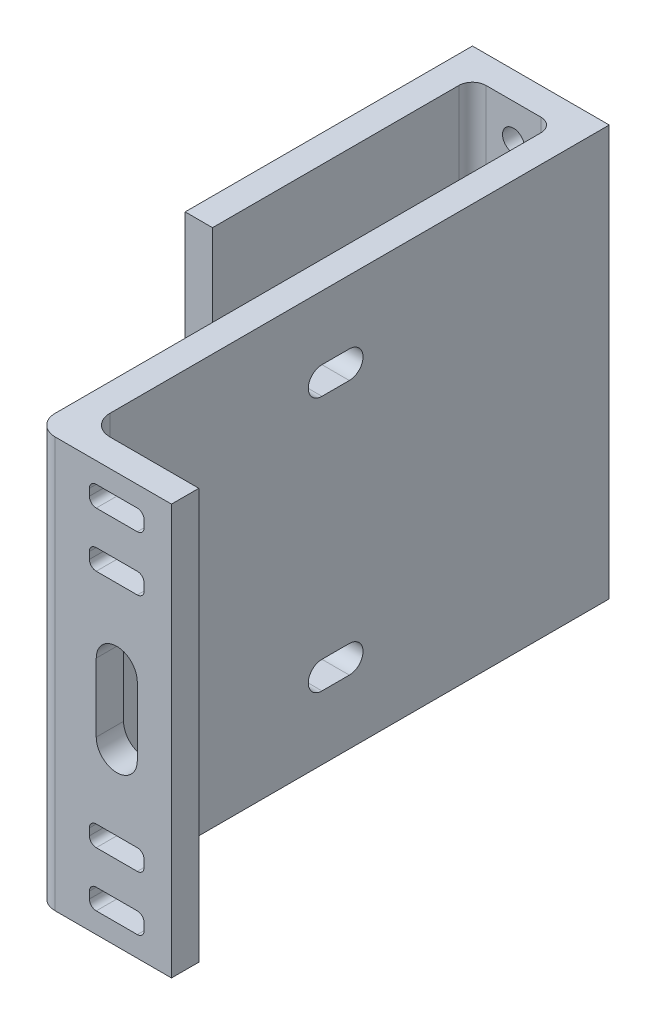
from build123d import *

# Parameters (mm, degrees)
BOSS_EXTRUDE1_DEPTH = 30
SKETCH2_W           = 8
SKETCH2_H           = 3
CUT_EXTRUDE1_DEPTH  = 86.743804441
FILLET1_R           = 1
CUT_EXTRUDE2_REACH  = 89.75
CUT_EXTRUDE3_REACH  = 86.119
SKETCH5_R           = 1.6
CUT_EXTRUDE4_DEPTH  = 86.743804441
FILLET2_R           = 2
FILLET3_R           = 3


with BuildPart() as part:
    # Sketch1 → Boss-Extrude1 (new, symmetric)
    with BuildSketch(Plane(origin=(0, 0, 0), x_dir=(1, 0, 0), z_dir=(0, 1, 0))):
        Polygon((-6, 0), (6, 0), (6, -76), (10, -76), (26, -76), (26, -72), (10, -72), (10, 4), (-10, 4), (-10, -38), (-6, -38), align=None)
    extrude(amount=BOSS_EXTRUDE1_DEPTH, both=True)

    # Sketch2 → Cut-Extrude1 (cut, through all)
    with BuildSketch(Plane(origin=(0, 0, 72), x_dir=(-1, 0, 0), z_dir=(0, 0, -1))):
        with BuildLine():
            Line((-21, -5), (-21, 5))
            ThreePointArc((-21, 5), (-18, 8), (-15, 5))
            Line((-15, 5), (-15, -5))
            ThreePointArc((-15, -5), (-18, -8), (-21, -5))
        make_face()
        with Locations((-18, 25.5)):
            Rectangle(SKETCH2_W, SKETCH2_H)
        with Locations((-18, 17.5)):
            Rectangle(SKETCH2_W, SKETCH2_H)
        with Locations((-18, -17.5)):
            Rectangle(SKETCH2_W, SKETCH2_H)
        with Locations((-18, -25.5)):
            Rectangle(SKETCH2_W, SKETCH2_H)
    extrude(amount=-CUT_EXTRUDE1_DEPTH, mode=Mode.SUBTRACT)

    # Fillet1
    fillet1_edges = [part.edges().sort_by_distance(p)[0] for p in [
        (22, 24, 74),
        (22, 27, 74),
        (14, 27, 74),
        (14, 24, 74),
        (22, 16, 74),
        (22, 19, 74),
        (14, 19, 74),
        (14, 16, 74),
        (14, -19, 74),
        (22, -19, 74),
        (22, -16, 74),
        (14, -16, 74),
        (14, -27, 74),
        (22, -27, 74),
        (22, -24, 74),
        (14, -24, 74),
    ]]
    fillet(fillet1_edges, radius=FILLET1_R)

    # Sketch3 → Cut-Extrude2 (cut, up to next)
    with BuildSketch(Plane(origin=(-6, 0, 0), x_dir=(0, 0, -1), z_dir=(1, 0, 0)), mode=Mode.PRIVATE) as cut_extrude2_sk1:
        with BuildLine():
            Line((-35.6, -2), (-35.6, 2))
            ThreePointArc((-35.6, 2), (-33.6, 4), (-31.6, 2))
            Line((-31.6, 2), (-31.6, -2))
            ThreePointArc((-31.6, -2), (-33.6, -4), (-35.6, -2))
        make_face()
    cut_extrude2_tool1 = extrude(cut_extrude2_sk1.sketch, amount=-CUT_EXTRUDE2_REACH, mode=Mode.PRIVATE) & part.part
    # Sketch3 → Cut-Extrude2 (cut, up to next)
    with BuildSketch(Plane(origin=(-6, 0, 0), x_dir=(0, 0, -1), z_dir=(1, 0, 0)), mode=Mode.PRIVATE) as cut_extrude2_sk2:
        with BuildLine():
            Line((-2.4, -2), (-2.4, 2))
            ThreePointArc((-2.4, 2), (-4.4, 4), (-6.4, 2))
            Line((-6.4, 2), (-6.4, -2))
            ThreePointArc((-6.4, -2), (-4.4, -4), (-2.4, -2))
        make_face()
    cut_extrude2_tool2 = extrude(cut_extrude2_sk2.sketch, amount=-CUT_EXTRUDE2_REACH, mode=Mode.PRIVATE) & part.part
    add(cut_extrude2_tool1.solids().sort_by_distance((-6, 0, 33.6))[0], mode=Mode.SUBTRACT)
    add(cut_extrude2_tool2.solids().sort_by_distance((-6, 0, 4.4))[0], mode=Mode.SUBTRACT)

    # Sketch4 → Cut-Extrude3 (cut, up to next)
    with BuildSketch(Plane(origin=(10, 0, 0), x_dir=(0, 0, -1), z_dir=(1, 0, 0)), mode=Mode.PRIVATE) as cut_extrude3_sk1:
        with BuildLine():
            Line((-38, 20.65), (-34, 20.65))
            ThreePointArc((-34, 20.65), (-32, 18.65), (-34, 16.65))
            Line((-34, 16.65), (-38, 16.65))
            ThreePointArc((-38, 16.65), (-40, 18.65), (-38, 20.65))
        make_face()
    cut_extrude3_tool1 = extrude(cut_extrude3_sk1.sketch, amount=-CUT_EXTRUDE3_REACH, mode=Mode.PRIVATE) & part.part
    # Sketch4 → Cut-Extrude3 (cut, up to next)
    with BuildSketch(Plane(origin=(10, 0, 0), x_dir=(0, 0, -1), z_dir=(1, 0, 0)), mode=Mode.PRIVATE) as cut_extrude3_sk2:
        with BuildLine():
            Line((-38, -20.65), (-34, -20.65))
            ThreePointArc((-34, -20.65), (-32, -18.65), (-34, -16.65))
            Line((-34, -16.65), (-38, -16.65))
            ThreePointArc((-38, -16.65), (-40, -18.65), (-38, -20.65))
        make_face()
    cut_extrude3_tool2 = extrude(cut_extrude3_sk2.sketch, amount=-CUT_EXTRUDE3_REACH, mode=Mode.PRIVATE) & part.part
    add(cut_extrude3_tool1.solids().sort_by_distance((10, 18.65, 36))[0], mode=Mode.SUBTRACT)
    add(cut_extrude3_tool2.solids().sort_by_distance((10, -18.65, 36))[0], mode=Mode.SUBTRACT)

    # Sketch5 → Cut-Extrude4 (cut, through all)
    with BuildSketch(Plane.XY):
        with Locations((0, 25)):
            Circle(SKETCH5_R)
        with Locations(Location((0, -25, 0), (0, 0, 180))):
            Circle(SKETCH5_R)
    extrude(amount=-CUT_EXTRUDE4_DEPTH, mode=Mode.SUBTRACT)

    # Fillet2
    fillet2_edges = [part.edges().sort_by_distance(p)[0] for p in [
        (6, 0, 0),
        (-6, 0, 0),
    ]]
    fillet(fillet2_edges, radius=FILLET2_R)

    # Fillet3
    fillet3_edges = [part.edges().sort_by_distance(p)[0] for p in [
        (10, 0, 72),
        (6, 0, 76),
    ]]
    fillet(fillet3_edges, radius=FILLET3_R)


solid = part.part
